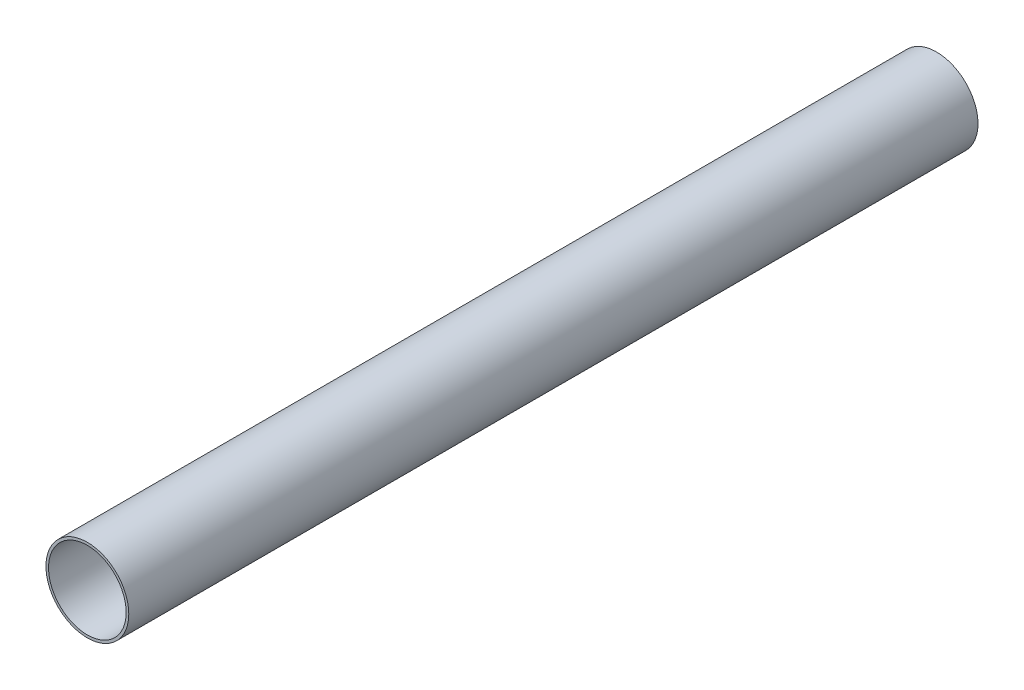
from build123d import *

# Parameters (mm, degrees)
SKETCH1_R           = 50.8
SKETCH1_R_2         = 47.625
BOSS_EXTRUDE1_DEPTH = 1041.4


with BuildPart() as part:
    # Sketch1 → Boss-Extrude1 (new body)
    with BuildSketch(Plane.XY):
        Circle(SKETCH1_R)
        Circle(SKETCH1_R_2, mode=Mode.SUBTRACT)
    extrude(amount=BOSS_EXTRUDE1_DEPTH)


solid = part.part
